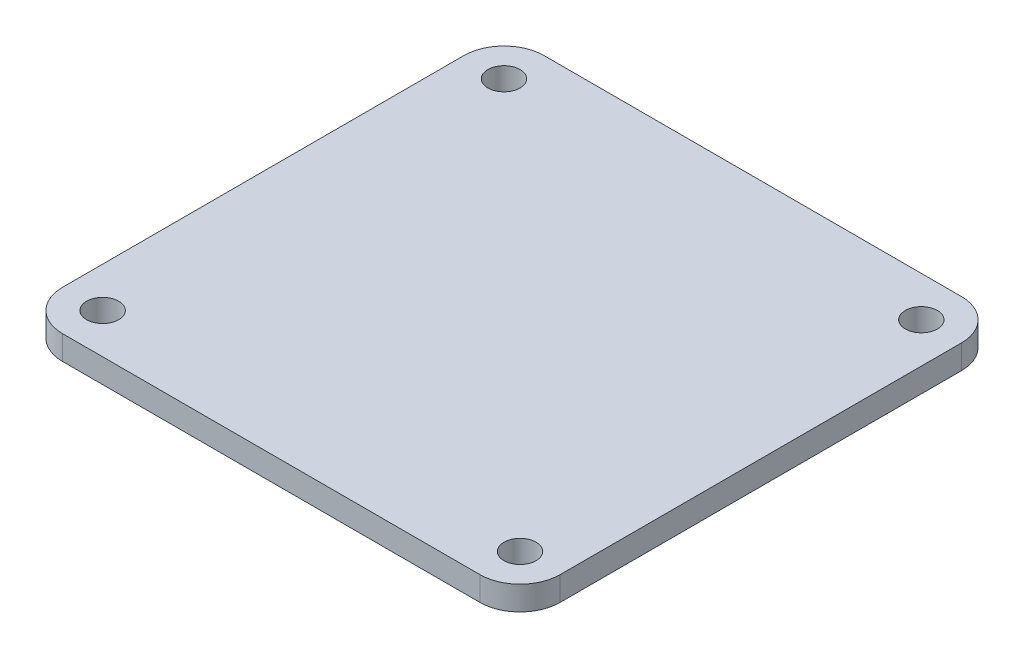
from build123d import *

# Parameters (mm, degrees)
SKETCH1_W                = 62
SKETCH1_H                = 60
BOSS_EXTRUDE1_DEPTH      = 3
F_4_0_4_DIAMETER_HOLE1_D = 4
FILLET1_R                = 5


with BuildPart() as part:
    # Sketch1 → Boss-Extrude1 (new body)
    with BuildSketch(Plane(origin=(0, 0, 0), x_dir=(1, 0, 0), z_dir=(0, 1, 0))):
        Rectangle(SKETCH1_W, SKETCH1_H)
    extrude(amount=BOSS_EXTRUDE1_DEPTH)

    # Ø4.0 (4) Diameter Hole1 (through all)
    with Locations(Plane(origin=(0, 3, 0), x_dir=(1, 0, 0), z_dir=(0, 1, 0))):
        with Locations((-26, 25), (26, -25), (26, 25), (-26, -25)):
            Hole(F_4_0_4_DIAMETER_HOLE1_D / 2)

    # Fillet1
    fillet1_edges = [part.edges().sort_by_distance(p)[0] for p in [
        (31, 1.5, 30),
        (-31, 1.5, 30),
        (-31, 1.5, -30),
        (31, 1.5, -30),
    ]]
    fillet(fillet1_edges, radius=FILLET1_R)


solid = part.part
